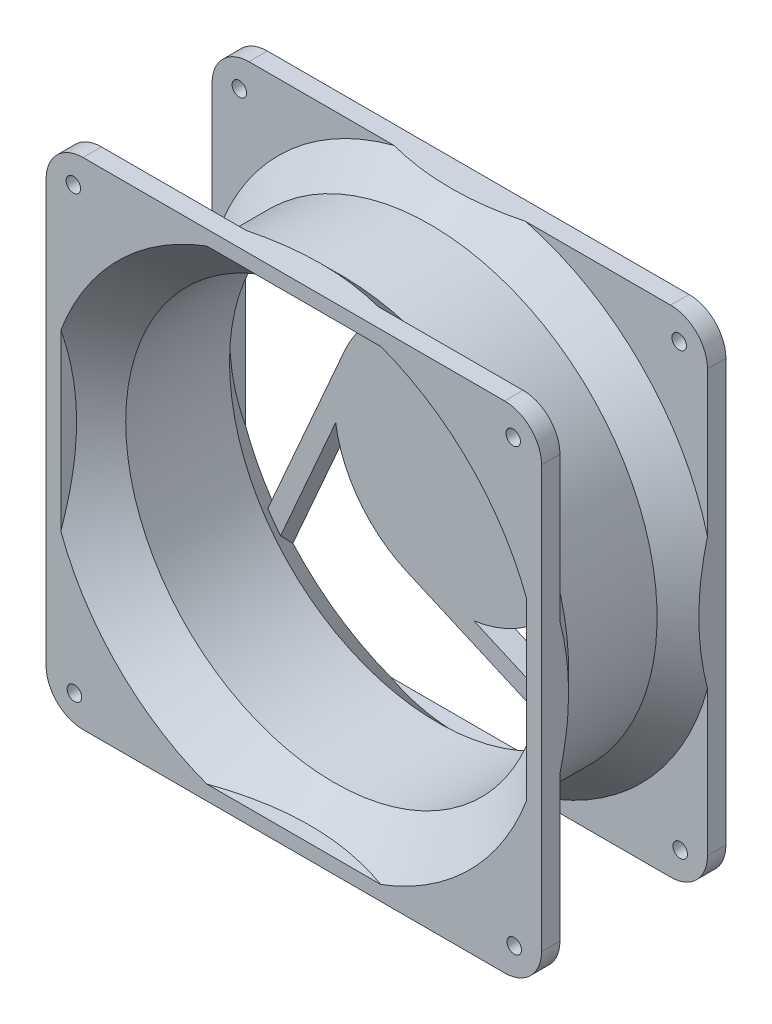
from build123d import *

# Parameters (mm, degrees)
CUT_EXTRUDE1_DEPTH      = 69.31434842
CUT_EXTRUDE1_DEPTH_BACK = 69.31434842
SKETCH3_OUTSIDE_W       = 124.306
SKETCH3_OUTSIDE_H       = 124.306
SKETCH3_OUTSIDE_W_2     = 67.161002078
SKETCH3_OUTSIDE_H_2     = 67.161002078
BOSS_EXTRUDE1_REACH     = 55.668
SKETCH4_W               = 35.612015526
SKETCH4_H               = 2
CIRPATTERN1_COUNT       = 4
MIRROR1_COPY_1_REACH    = 55.668
MIRROR1_COPY_1_SKETCH_W = 35.612015526
MIRROR1_COPY_1_SKETCH_H = 2
MIRROR1_COPY_2_REACH    = 55.668
MIRROR1_COPY_2_SKETCH_W = 35.612015526
MIRROR1_COPY_2_SKETCH_H = 2
MIRROR1_COPY_3_REACH    = 55.668
MIRROR1_COPY_3_SKETCH_W = 35.612015526
MIRROR1_COPY_3_SKETCH_H = 2
FILLET1_R               = 5
BOSS_EXTRUDE2_DEPTH     = 3
SKETCH8_R               = 9.506408827
CUT_EXTRUDE3_DEPTH      = 0.01
CUT_EXTRUDE4_DEPTH      = 0.01
SCALE1_SCALE            = 1.79
CUT_EXTRUDE5_REACH      = 98.066
SKETCH10_R              = 1.757559929
SCALE3_SCALE            = 0.67


with BuildPart() as part:
    # Sketch2 → Revolve1 (revolve)
    with BuildSketch(Plane(origin=(0, 0, 0), x_dir=(0, 0, -1), z_dir=(1, 0, 0)), mode=Mode.PRIVATE) as revolve1_sk:
        Polygon((-6, 30.75), (6, 30.75), (10, 34.75), (10, 47.49), (12.5, 47.49), (12.5, 33.714466094), (7.035533906, 28.25), (-7.035533906, 28.25), (-12.5, 33.714466094), (-12.5, 47.49), (-10, 47.49), (-10, 34.75), align=None)
    revolve(revolve1_sk.sketch.rotate(Axis((0, 0, -4.682926829), (0, 0, 1)), 90), axis=Axis((0, 0, -4.682926829), (0, 0, 1)))

    # Sketch3 outside → Cut-Extrude1 (cut, two sides: drawn at the far end of the back side and taken through both)
    with BuildSketch(Plane.XY.offset(-CUT_EXTRUDE1_DEPTH_BACK)):
        Rectangle(SKETCH3_OUTSIDE_W, SKETCH3_OUTSIDE_H)
        Rectangle(SKETCH3_OUTSIDE_W_2, SKETCH3_OUTSIDE_H_2, mode=Mode.SUBTRACT)
    extrude(amount=CUT_EXTRUDE1_DEPTH + CUT_EXTRUDE1_DEPTH_BACK, mode=Mode.SUBTRACT)

    # Sketch4 → Boss-Extrude1 (add, up to next)
    with BuildSketch(Plane.XY.offset(12.5), mode=Mode.PRIVATE) as boss_extrude1_sk1:
        with Locations((-0.485506724, 32.580501039)):
            Rectangle(SKETCH4_W, SKETCH4_H)
    boss_extrude1_tool1 = extrude(boss_extrude1_sk1.sketch, amount=-BOSS_EXTRUDE1_REACH, mode=Mode.PRIVATE) - part.part
    boss_extrude1 = boss_extrude1_tool1.solids().sort_by_distance((-0.485507, 32.580501, 12.5))[0]
    add(boss_extrude1)

    # CirPattern1: Boss-Extrude1 ×4 about axis
    cirpattern1_axis = Axis((0, 0, 0), (0, 0, 1))
    for i in range(1, CIRPATTERN1_COUNT):
        add(boss_extrude1.rotate(cirpattern1_axis, i * 360 / CIRPATTERN1_COUNT))

    # Mirror1: Boss-Extrude1 across plane
    add(boss_extrude1.mirror(Plane.XY))

    # Mirror1 copy 1 sketch → Mirror1 copy 1 (add, up to next)
    with BuildSketch(Plane.YX.offset(12.5), mode=Mode.PRIVATE) as mirror1_copy_1_sk1:
        with Locations((-0.485506724, -32.580501039)):
            Rectangle(MIRROR1_COPY_1_SKETCH_W, MIRROR1_COPY_1_SKETCH_H)
    mirror1_copy_1_tool1 = extrude(mirror1_copy_1_sk1.sketch, amount=-MIRROR1_COPY_1_REACH, mode=Mode.PRIVATE) - part.part
    add(mirror1_copy_1_tool1.solids().sort_by_distance((-32.580501, -0.485507, -12.5))[0])

    # Mirror1 copy 2 sketch → Mirror1 copy 2 (add, up to next)
    with BuildSketch(Plane(origin=(0, 0, -12.5), x_dir=(-1, 0, 0), z_dir=(0, 0, -1)), mode=Mode.PRIVATE) as mirror1_copy_2_sk1:
        with Locations((-0.485506724, -32.580501039)):
            Rectangle(MIRROR1_COPY_2_SKETCH_W, MIRROR1_COPY_2_SKETCH_H)
    mirror1_copy_2_tool1 = extrude(mirror1_copy_2_sk1.sketch, amount=-MIRROR1_COPY_2_REACH, mode=Mode.PRIVATE) - part.part
    add(mirror1_copy_2_tool1.solids().sort_by_distance((0.485507, -32.580501, -12.5))[0])

    # Mirror1 copy 3 sketch → Mirror1 copy 3 (add, up to next)
    with BuildSketch(Plane(origin=(0, 0, -12.5), x_dir=(0, -1, 0), z_dir=(0, 0, -1)), mode=Mode.PRIVATE) as mirror1_copy_3_sk1:
        with Locations((-0.485506724, -32.580501039)):
            Rectangle(MIRROR1_COPY_3_SKETCH_W, MIRROR1_COPY_3_SKETCH_H)
    mirror1_copy_3_tool1 = extrude(mirror1_copy_3_sk1.sketch, amount=-MIRROR1_COPY_3_REACH, mode=Mode.PRIVATE) - part.part
    add(mirror1_copy_3_tool1.solids().sort_by_distance((32.580501, 0.485507, -12.5))[0])

    # Fillet1
    fillet1_edges = [part.edges().sort_by_distance(p)[0] for p in [
        (-33.580501039, 33.580501039, -11.25),
        (33.580501039, 33.580501039, -11.25),
        (33.580501039, -33.580501039, -11.25),
        (-33.580501039, -33.580501039, -11.25),
        (-33.580501039, 33.580501039, 11.25),
        (33.580501039, 33.580501039, 11.25),
        (33.580501039, -33.580501039, 11.25),
        (-33.580501039, -33.580501039, 11.25),
    ]]
    fillet(fillet1_edges, radius=FILLET1_R)

    # Sketch5 → Boss-Extrude2 (add)
    with BuildSketch(Plane(origin=(0, 0, -12.5), x_dir=(-1, 0, 0), z_dir=(0, 0, -1))):
        with BuildLine():
            Line((26.925347553, -20.290167154), (15.108670537, 6.631596687))
            ThreePointArc((15.108670537, 6.631596687), (10.016146833, 13.112086127), (2.424441224, 16.320909434))
            Line((2.424441224, 16.320909434), (22.48161384, 25.124535083))
            ThreePointArc((22.48161384, 25.124535083), (21.404836924, 26.047997625), (20.290167154, 26.925347553))
            Line((20.290167154, 26.925347553), (-6.631596687, 15.108670537))
            ThreePointArc((-6.631596687, 15.108670537), (-13.112086127, 10.016146833), (-16.320909434, 2.424441224))
            Line((-16.320909434, 2.424441224), (-25.124535083, 22.48161384))
            ThreePointArc((-25.124535083, 22.48161384), (-26.047997625, 21.404836924), (-26.925347553, 20.290167154))
            Line((-26.925347553, 20.290167154), (-15.108670537, -6.631596687))
            ThreePointArc((-15.108670537, -6.631596687), (-10.016146833, -13.112086127), (-2.424441224, -16.320909434))
            Line((-2.424441224, -16.320909434), (-22.48161384, -25.124535083))
            ThreePointArc((-22.48161384, -25.124535083), (-21.404836924, -26.047997625), (-20.290167154, -26.925347553))
            Line((-20.290167154, -26.925347553), (6.631596687, -15.108670537))
            ThreePointArc((6.631596687, -15.108670537), (13.112086127, -10.016146833), (16.320909434, -2.424441224))
            Line((16.320909434, -2.424441224), (25.124535083, -22.48161384))
            ThreePointArc((25.124535083, -22.48161384), (26.047997625, -21.404836924), (26.925347553, -20.290167154))
        make_face()
    extrude(amount=-BOSS_EXTRUDE2_DEPTH)

    # Sketch8 → Cut-Extrude3 (cut)
    with BuildSketch(Plane(origin=(0, 0, -12.5), x_dir=(-1, 0, 0), z_dir=(0, 0, -1))):
        Circle(SKETCH8_R)
    extrude(amount=-CUT_EXTRUDE3_DEPTH, mode=Mode.SUBTRACT)

    # Sketch9 → Cut-Extrude4 (cut)
    with BuildSketch(Plane(origin=(0, 0, -12.49), x_dir=(-1, 0, 0), z_dir=(0, 0, -1))):
        with BuildLine():
            Line((0.675180288, 4.913461538), (0.852564103, 4.617588141))
            add(Edge.make_bspline(
                [(0.852564103, 4.617588141), (0.806499718, 4.590069904), (0.718242134, 4.537346023), (0.598984093, 4.449394664), (0.497621937, 4.358261753), (0.414745329, 4.263272419), (0.349496442, 4.165006471), (0.303294211, 4.062822417), (0.274478235, 3.957064607), (0.270978149, 3.885090785), (0.269230769, 3.849158654)],
                knots=[0, 0, 0, 0, 1.272034388, 2.437168799, 3.508375237, 4.49857839, 5.41946034, 6.295179144, 7.148887113, 8, 8, 8, 8], degree=3))
            add(Edge.make_bspline(
                [(0.269230769, 3.849158654), (0.270085441, 3.81847179), (0.271779829, 3.757635011), (0.288060647, 3.668072814), (0.313072716, 3.581090837), (0.348893869, 3.498482855), (0.392231555, 3.421384873), (0.444580544, 3.353786497), (0.503176771, 3.295310861), (0.568595717, 3.247609116), (0.63870863, 3.210577942), (0.711319991, 3.18378116), (0.786110405, 3.16672662), (0.836816049, 3.164555919), (0.862379808, 3.163461538)],
                knots=[0, 0, 0, 0, 1.095270387, 2.171376115, 3.241375676, 4.322296363, 5.380636668, 6.392615365, 7.366724986, 8.328592944, 9.273498763, 10.190095884, 11.087518669, 12, 12, 12, 12], degree=3))
            add(Edge.make_bspline(
                [(0.862379808, 3.163461538), (0.891520657, 3.164935849), (0.950759747, 3.167932907), (1.0381594, 3.193264387), (1.12465197, 3.233113634), (1.178153235, 3.269876278), (1.205929487, 3.28896234)],
                knots=[0, 0, 0, 0, 0.938893495, 1.908633276, 2.914225137, 4, 4, 4, 4], degree=3))
            add(Edge.make_bspline(
                [(1.205929487, 3.28896234), (1.226017291, 3.304588591), (1.268312913, 3.337490246), (1.330218384, 3.394836934), (1.395634226, 3.460378655), (1.464294802, 3.534443072), (1.534946198, 3.618502429), (1.609061151, 3.710830671), (1.686416915, 3.811905743), (1.737571527, 3.883138886), (1.764022436, 3.919971955)],
                knots=[0, 0, 0, 0, 0.72226686, 1.520759855, 2.393439377, 3.351307446, 4.386958158, 5.510256019, 6.712608938, 8, 8, 8, 8], degree=3))
            add(Edge.make_bspline(
                [(1.764022436, 3.919971955), (1.790257027, 3.956791039), (1.840415567, 4.027186325), (1.914762239, 4.125708409), (1.983169392, 4.213690719), (2.044684139, 4.291581568), (2.101989442, 4.357365822), (2.152014057, 4.413448369), (2.197429242, 4.457760112), (2.226867212, 4.482418552), (2.240084135, 4.493489583)],
                knots=[0, 0, 0, 0, 1.452255772, 2.776602448, 3.96446981, 5.032613149, 5.964194703, 6.766668629, 7.446264616, 8, 8, 8, 8], degree=3))
            add(Edge.make_bspline(
                [(2.240084135, 4.493489583), (2.260685171, 4.508962129), (2.301199875, 4.539390965), (2.364524733, 4.579556971), (2.429347998, 4.613696134), (2.495843863, 4.640458466), (2.563078792, 4.662994685), (2.631930038, 4.678152615), (2.702088656, 4.687644012), (2.749302157, 4.688615999), (2.772936699, 4.689102564)],
                knots=[0, 0, 0, 0, 1.068054152, 2.10047183, 3.106115577, 4.101338837, 5.06977816, 6.043150881, 7.020423561, 8, 8, 8, 8], degree=3))
            add(Edge.make_bspline(
                [(2.772936699, 4.689102564), (2.809969574, 4.687803049), (2.883243772, 4.685231794), (2.990229619, 4.663308672), (3.092684247, 4.629110052), (3.188350891, 4.579648834), (3.277005834, 4.518496454), (3.357294574, 4.446223947), (3.425365503, 4.360416253), (3.484150669, 4.26574367), (3.530564015, 4.162785973), (3.565761611, 4.05509199), (3.585439222, 3.942189479), (3.588294703, 3.865589842), (3.58974359, 3.826722756)],
                knots=[0, 0, 0, 0, 1.005541892, 1.989591032, 2.955705311, 3.932863626, 4.905387107, 5.876519979, 6.856563935, 7.871847665, 8.897921447, 9.918317993, 10.943742853, 12, 12, 12, 12], degree=3))
            add(Edge.make_bspline(
                [(3.58974359, 3.826722756), (3.588347686, 3.785472508), (3.585579443, 3.703668333), (3.560648427, 3.583112286), (3.520376942, 3.466818515), (3.47399396, 3.373207727), (3.427876069, 3.300070601), (3.385853249, 3.244298835), (3.33747903, 3.187781097), (3.282619521, 3.130063127), (3.220772848, 3.072122443), (3.152362136, 3.013098998), (3.077805587, 2.952854727), (3.024581085, 2.914098867), (2.997295673, 2.894230769)],
                knots=[0, 0, 0, 0, 1.286821612, 2.551921131, 3.825787379, 5.12137259, 5.803616487, 6.523126609, 7.299589446, 8.125436757, 9.008162487, 9.944516264, 10.946261234, 12, 12, 12, 12], degree=3))
            Line((2.997295673, 2.894230769), (2.782051282, 3.178185096))
            add(Edge.make_bspline(
                [(2.782051282, 3.178185096), (2.804139973, 3.195331028), (2.846677627, 3.228350085), (2.906248935, 3.278479575), (2.960665442, 3.325728214), (3.007930479, 3.372278643), (3.050632911, 3.415672179), (3.087191686, 3.457789534), (3.11797047, 3.49802287), (3.150800721, 3.548744018), (3.183551326, 3.61262958), (3.210674418, 3.692745333), (3.227560433, 3.776240418), (3.229687874, 3.832952608), (3.230769231, 3.861778846)],
                knots=[0, 0, 0, 0, 1.181667846, 2.275615987, 3.290305621, 4.226321945, 5.078535498, 5.862783384, 6.581873284, 7.217493746, 8.414623899, 9.604724551, 10.782505457, 12, 12, 12, 12], degree=3))
            add(Edge.make_bspline(
                [(3.230769231, 3.861778846), (3.229557531, 3.897935369), (3.227220882, 3.967659816), (3.201700896, 4.066650052), (3.161519036, 4.155743977), (3.105204058, 4.232296542), (3.038483065, 4.296033519), (2.96170421, 4.342138978), (2.876921808, 4.369889143), (2.817780151, 4.373275422), (2.787660256, 4.375)],
                knots=[0, 0, 0, 0, 1.14458467, 2.207223713, 3.21896685, 4.227309161, 5.202851033, 6.127160689, 7.046193047, 8, 8, 8, 8], degree=3))
            add(Edge.make_bspline(
                [(2.787660256, 4.375), (2.768913559, 4.374588572), (2.731389509, 4.373765043), (2.675804871, 4.36305417), (2.620713639, 4.347866473), (2.565870844, 4.325638344), (2.509986268, 4.295698052), (2.453210792, 4.254988255), (2.394110972, 4.204058624), (2.355710822, 4.164969048), (2.335436699, 4.144330929)],
                knots=[0, 0, 0, 0, 0.858526328, 1.718456515, 2.587092892, 3.476767204, 4.426280253, 5.487868114, 6.673670035, 8, 8, 8, 8], degree=3))
            add(Edge.make_bspline(
                [(2.335436699, 4.144330929), (2.328599673, 4.136669557), (2.312356465, 4.11846789), (2.285764184, 4.085191964), (2.252961412, 4.041249166), (2.212374095, 3.987786965), (2.165292633, 3.923819603), (2.112319021, 3.849340047), (2.051733562, 3.765178514), (2.009376021, 3.705456598), (1.986979167, 3.673878205)],
                knots=[0, 0, 0, 0, 0.420754252, 0.999615792, 1.744751191, 2.668019286, 3.750313428, 4.999500688, 6.413464383, 8, 8, 8, 8], degree=3))
            add(Edge.make_bspline(
                [(1.986979167, 3.673878205), (1.959337807, 3.635892292), (1.905814145, 3.562337835), (1.825398465, 3.457680256), (1.746750697, 3.362786447), (1.67037309, 3.277323244), (1.596844997, 3.200446335), (1.525281816, 3.133008615), (1.456196244, 3.074322934), (1.367623668, 3.011143716), (1.258842584, 2.946585896), (1.125564345, 2.891144389), (0.991768025, 2.856186042), (0.901841188, 2.851614526), (0.857471955, 2.849358974)],
                knots=[0, 0, 0, 0, 1.163667725, 2.253281268, 3.268753668, 4.215851969, 5.092017293, 5.902905408, 6.650798638, 7.335211899, 8.59617414, 9.77448103, 10.901945474, 12, 12, 12, 12], degree=3))
            add(Edge.make_bspline(
                [(0.857471955, 2.849358974), (0.826093837, 2.850016478), (0.763946944, 2.851318716), (0.67268827, 2.866274321), (0.584070778, 2.888213729), (0.499109563, 2.921177025), (0.416667774, 2.961724993), (0.337504814, 3.011807554), (0.262708929, 3.072182048), (0.190723622, 3.139285854), (0.125700195, 3.213860485), (0.067544021, 3.292492297), (0.01886767, 3.375691775), (-0.020316919, 3.463056226), (-0.051449277, 3.554102367), (-0.073826566, 3.648926014), (-0.08759193, 3.747791221), (-0.089018363, 3.814992295), (-0.08974359, 3.849158654)],
                knots=[0, 0, 0, 0, 0.983610584, 1.948120116, 2.894308362, 3.843560551, 4.801159957, 5.773581695, 6.77566113, 7.813174769, 8.857584665, 9.875476876, 10.877851407, 11.875574773, 12.875048225, 13.892438445, 14.928473903, 16, 16, 16, 16], degree=3))
            add(Edge.make_bspline(
                [(-0.08974359, 3.849158654), (-0.089226551, 3.87559283), (-0.088198985, 3.928128272), (-0.079329853, 4.005625969), (-0.066323164, 4.081700573), (-0.046492674, 4.155396877), (-0.021866355, 4.227632532), (0.00828501, 4.297763652), (0.044178677, 4.365960624), (0.085874098, 4.432303084), (0.133926601, 4.497416168), (0.189458269, 4.56096606), (0.252085534, 4.623679776), (0.322450651, 4.684407677), (0.399801843, 4.744269137), (0.484787237, 4.802150925), (0.576965667, 4.859231683), (0.6418306, 4.895047287), (0.675180288, 4.913461538)],
                knots=[0, 0, 0, 0, 0.915384692, 1.819241058, 2.699029451, 3.586605375, 4.459625921, 5.340865773, 6.228072412, 7.126546901, 8.052715223, 9.028303326, 10.047266019, 11.120332924, 12.245748783, 13.433636234, 14.680528497, 16, 16, 16, 16], degree=3))
        make_face()
        Polygon((2.557692308, 1.144230769), (2.557692308, 0.805588942), (0.598758013, -0.060296474), (2.557692308, -0.939503205), (2.557692308, -1.278846154), (-0.942307692, 0.291666667), (-0.942307692, 0.631009615), (0.218048878, 0.110076122), align=None)
        with BuildLine():
            Line((3.5, -4.28525641), (3.5, -4.599358974))
            Line((3.5, -4.599358974), (1.136518429, -4.599358974))
            add(Edge.make_bspline(
                [(1.136518429, -4.599358974), (1.092812917, -4.599047697), (1.008893, -4.598450007), (0.888023601, -4.595100811), (0.777637927, -4.589083271), (0.67759751, -4.579777611), (0.587920109, -4.5690564), (0.50830743, -4.555148032), (0.439154854, -4.538702564), (0.361542044, -4.513790464), (0.276140858, -4.473168766), (0.1846454, -4.410885966), (0.103958256, -4.334795343), (0.034149099, -4.246430162), (-0.021520188, -4.145306888), (-0.061472003, -4.033403716), (-0.085843802, -3.911438518), (-0.088417574, -3.826839109), (-0.08974359, -3.783253205)],
                knots=[0, 0, 0, 0, 1.237549021, 2.376245131, 3.423509879, 4.367128923, 5.220764738, 5.980167839, 6.654279555, 7.23186528, 8.285695362, 9.319068926, 10.353713031, 11.414109097, 12.495220016, 13.606748513, 14.766988686, 16, 16, 16, 16], degree=3))
            add(Edge.make_bspline(
                [(-0.08974359, -3.783253205), (-0.088697799, -3.749055471), (-0.086607883, -3.68071443), (-0.068540702, -3.578865317), (-0.04175024, -3.477542371), (-0.001239928, -3.376070295), (0.052924018, -3.272302912), (0.124152448, -3.164744448), (0.211970539, -3.052116365), (0.279010274, -2.977933803), (0.314102564, -2.939102564)],
                knots=[0, 0, 0, 0, 0.854372818, 1.707385869, 2.579105618, 3.471016644, 4.432770875, 5.500780854, 6.691771033, 8, 8, 8, 8], degree=3))
            Line((0.314102564, -2.939102564), (0.583333333, -3.124198718))
            add(Edge.make_bspline(
                [(0.583333333, -3.124198718), (0.553940671, -3.166934339), (0.498556334, -3.247460698), (0.426333146, -3.36555087), (0.365625675, -3.470906823), (0.334215346, -3.539733508), (0.319711538, -3.571514423)],
                knots=[0, 0, 0, 0, 1.196704426, 2.25493972, 3.19421351, 4, 4, 4, 4], degree=3))
            add(Edge.make_bspline(
                [(0.319711538, -3.571514423), (0.312152081, -3.590798735), (0.297326302, -3.628619564), (0.280780404, -3.686444644), (0.271737994, -3.743939681), (0.270056661, -3.782057374), (0.269230769, -3.80078125)],
                knots=[0, 0, 0, 0, 1.051806502, 2.062826769, 3.048436908, 4, 4, 4, 4], degree=3))
            add(Edge.make_bspline(
                [(0.269230769, -3.80078125), (0.270221373, -3.824972996), (0.272170121, -3.872563779), (0.290411058, -3.941896433), (0.317154531, -4.008540904), (0.357284706, -4.069750541), (0.404691168, -4.126027342), (0.462024835, -4.172545731), (0.525781783, -4.211008571), (0.585651457, -4.235316157), (0.640678911, -4.249975791), (0.691030459, -4.259685634), (0.750129188, -4.266712725), (0.817602959, -4.274283847), (0.893914761, -4.2783622), (0.978713384, -4.283118983), (1.072242971, -4.284812253), (1.137453677, -4.28510384), (1.171574519, -4.28525641)],
                knots=[0, 0, 0, 0, 0.99710849, 1.961544003, 2.943780681, 3.950512064, 4.9701611, 5.971139155, 6.984143068, 8.036211364, 8.626223178, 9.334153146, 10.151809154, 11.083375733, 12.13756692, 13.306844995, 14.590833851, 16, 16, 16, 16], degree=3))
            Line((1.171574519, -4.28525641), (3.5, -4.28525641))
        make_face()
    extrude(amount=-CUT_EXTRUDE4_DEPTH, mode=Mode.SUBTRACT)


with BuildPart() as part_1:
    # Scale1: scaled about (0, 0, 0)
    add(part.part.scale(SCALE1_SCALE))

    # Sketch10 → Cut-Extrude5 (cut, up to next)
    with BuildSketch(Plane(origin=(0, 0, -22.375), x_dir=(-1, 0, 0), z_dir=(0, 0, -1)), mode=Mode.PRIVATE) as cut_extrude5_sk1:
        with Locations((53.486626347, 53.238620352)):
            Circle(SKETCH10_R)
    cut_extrude5_tool1 = extrude(cut_extrude5_sk1.sketch, amount=-CUT_EXTRUDE5_REACH, mode=Mode.PRIVATE) & part_1.part
    # Sketch10 → Cut-Extrude5 (cut, up to next)
    with BuildSketch(Plane(origin=(0, 0, -22.375), x_dir=(-1, 0, 0), z_dir=(0, 0, -1)), mode=Mode.PRIVATE) as cut_extrude5_sk2:
        with Locations((53.238620352, -53.486626347)):
            Circle(SKETCH10_R)
    cut_extrude5_tool2 = extrude(cut_extrude5_sk2.sketch, amount=-CUT_EXTRUDE5_REACH, mode=Mode.PRIVATE) & part_1.part
    # Sketch10 → Cut-Extrude5 (cut, up to next)
    with BuildSketch(Plane(origin=(0, 0, -22.375), x_dir=(-1, 0, 0), z_dir=(0, 0, -1)), mode=Mode.PRIVATE) as cut_extrude5_sk3:
        with Locations((-53.486626347, -53.238620352)):
            Circle(SKETCH10_R)
    cut_extrude5_tool3 = extrude(cut_extrude5_sk3.sketch, amount=-CUT_EXTRUDE5_REACH, mode=Mode.PRIVATE) & part_1.part
    # Sketch10 → Cut-Extrude5 (cut, up to next)
    with BuildSketch(Plane(origin=(0, 0, -22.375), x_dir=(-1, 0, 0), z_dir=(0, 0, -1)), mode=Mode.PRIVATE) as cut_extrude5_sk4:
        with Locations((-53.238620352, 53.486626347)):
            Circle(SKETCH10_R)
    cut_extrude5_tool4 = extrude(cut_extrude5_sk4.sketch, amount=-CUT_EXTRUDE5_REACH, mode=Mode.PRIVATE) & part_1.part
    add(cut_extrude5_tool1.solids().sort_by_distance((-53.486626, 53.23862, -22.375))[0], mode=Mode.SUBTRACT)
    add(cut_extrude5_tool1.solids().sort_by_distance((-53.486626, 53.23862, -22.375))[1], mode=Mode.SUBTRACT)
    add(cut_extrude5_tool2.solids().sort_by_distance((-53.23862, -53.486626, -22.375))[0], mode=Mode.SUBTRACT)
    add(cut_extrude5_tool2.solids().sort_by_distance((-53.23862, -53.486626, -22.375))[1], mode=Mode.SUBTRACT)
    add(cut_extrude5_tool3.solids().sort_by_distance((53.486626, -53.23862, -22.375))[0], mode=Mode.SUBTRACT)
    add(cut_extrude5_tool3.solids().sort_by_distance((53.486626, -53.23862, -22.375))[1], mode=Mode.SUBTRACT)
    add(cut_extrude5_tool4.solids().sort_by_distance((53.23862, 53.486626, -22.375))[0], mode=Mode.SUBTRACT)
    add(cut_extrude5_tool4.solids().sort_by_distance((53.23862, 53.486626, -22.375))[1], mode=Mode.SUBTRACT)


with BuildPart() as part_2:
    # Scale3: scaled about (0, 0, 0)
    add(part_1.part.scale(SCALE3_SCALE))


solid = part_2.part
